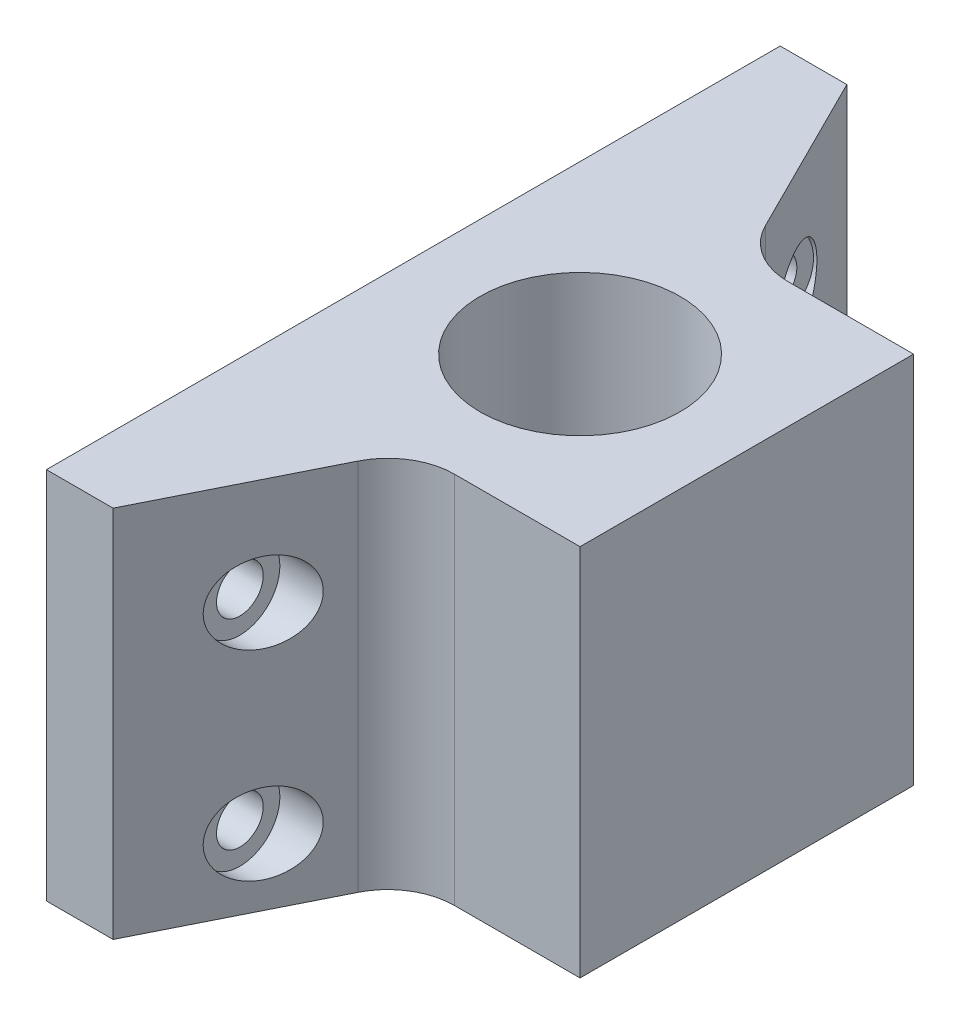
from build123d import *

# Parameters (mm, degrees)
SKETCH1_W           = 25
SKETCH1_H           = 25
BOSS_EXTRUDE1_DEPTH = 28
SKETCH2_R           = 5
CUT_EXTRUDE1_DEPTH  = 30
SKETCH3_R           = 7.5
CUT_EXTRUDE2_DEPTH  = 25
BOSS_EXTRUDE2_DEPTH = 28
FILLET1_R           = 5
SKETCH7_R           = 1.75
CUT_EXTRUDE3_DEPTH  = 13
SKETCH8_R           = 3
CUT_EXTRUDE4_DEPTH  = 18


with BuildPart() as part:
    # Sketch1 → Boss-Extrude1 (new body)
    with BuildSketch(Plane(origin=(0, 0, 0), x_dir=(1, 0, 0), z_dir=(0, 1, 0))):
        Rectangle(SKETCH1_W, SKETCH1_H)
    extrude(amount=BOSS_EXTRUDE1_DEPTH)

    # Sketch2 → Cut-Extrude1 (cut)
    with BuildSketch(Plane(origin=(0, 28, 0), x_dir=(1, 0, 0), z_dir=(0, 1, 0))):
        with Locations(Location((0, 0, 0), (0, 0, 270))):
            Circle(SKETCH2_R)
    extrude(amount=-CUT_EXTRUDE1_DEPTH, mode=Mode.SUBTRACT)

    # Sketch3 → Cut-Extrude2 (cut)
    with BuildSketch(Plane(origin=(0, 28, 0), x_dir=(1, 0, 0), z_dir=(0, 1, 0))):
        with Locations(Location((0, 0, 0), (0, 0, 270))):
            Circle(SKETCH3_R)
    extrude(amount=-CUT_EXTRUDE2_DEPTH, mode=Mode.SUBTRACT)

    # Sketch6 → Boss-Extrude2 (add)
    with BuildSketch(Plane.XZ):
        Polygon((-12.5, -12.5), (-12.5, -27.5), (-7.5, -27.5), (0, -12.5), align=None)
        Polygon((-7.5, 27.5), (0, 12.5), (-12.5, 12.5), (-12.5, 27.5), align=None)
    extrude(amount=-BOSS_EXTRUDE2_DEPTH)

    # Fillet1
    fillet1_edges = [part.edges().sort_by_distance(p)[0] for p in [
        (0, 14, -12.5),
        (0, 14, 12.5),
    ]]
    fillet(fillet1_edges, radius=FILLET1_R)

    # Sketch7 → Cut-Extrude3 (cut)
    with BuildSketch(Plane.ZY.offset(12.5)):
        with Locations((20, 20)):
            Circle(SKETCH7_R)
        with Locations((20, 5)):
            Circle(SKETCH7_R)
        with Locations(Location((-20, 20, 0), (0, 0, 180))):
            Circle(SKETCH7_R)
        with Locations(Location((-20, 5, 0), (0, 0, 180))):
            Circle(SKETCH7_R)
    extrude(amount=-CUT_EXTRUDE3_DEPTH, mode=Mode.SUBTRACT)

    # Sketch8 → Cut-Extrude4 (cut)
    with BuildSketch(Plane(origin=(12.5, 0, 0), x_dir=(0, 0, -1), z_dir=(1, 0, 0))):
        with Locations((20, 20)):
            Circle(SKETCH8_R)
        with Locations((20, 5)):
            Circle(SKETCH8_R)
        with Locations((-20, 20)):
            Circle(SKETCH8_R)
        with Locations((-20, 5)):
            Circle(SKETCH8_R)
    extrude(amount=-CUT_EXTRUDE4_DEPTH, mode=Mode.SUBTRACT)


solid = part.part
